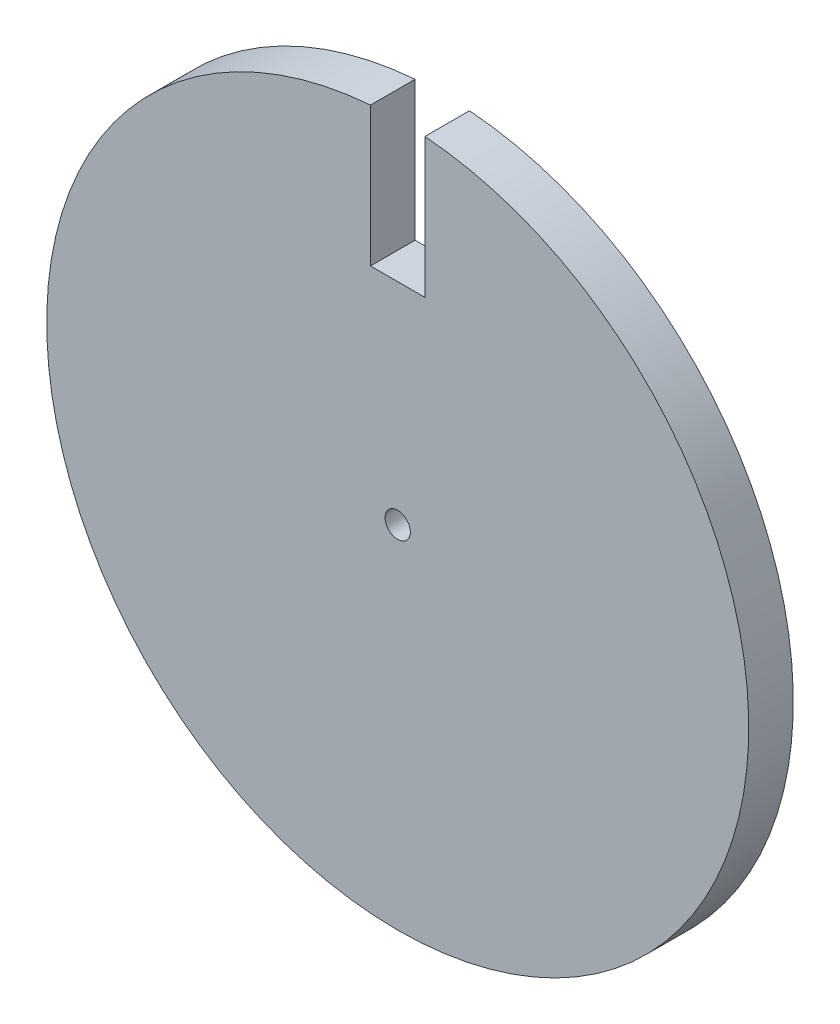
from build123d import *

# Parameters (mm, degrees)
SKETCH1_R           = 25
SKETCH1_R_2         = 0.9
BOSS_EXTRUDE1_DEPTH = 1.5875
CUT_EXTRUDE1_REACH  = 37.498
SKETCH2_W           = 3.873993702
SKETCH2_H           = 19.044786736


with BuildPart() as part:
    # Sketch1 → Boss-Extrude1 (new, symmetric)
    with BuildSketch(Plane.XY):
        Circle(SKETCH1_R)
        Circle(SKETCH1_R_2, mode=Mode.SUBTRACT)
    extrude(amount=BOSS_EXTRUDE1_DEPTH, both=True)

    # Sketch2 → Cut-Extrude1 (cut, up to next)
    with BuildSketch(Plane(origin=(0, 0, -1.5875), x_dir=(-1, 0, 0), z_dir=(0, 0, -1)), mode=Mode.PRIVATE) as cut_extrude1_sk1:
        with Locations((0, 24.522393368)):
            Rectangle(SKETCH2_W, SKETCH2_H)
    cut_extrude1_tool1 = extrude(cut_extrude1_sk1.sketch, amount=-CUT_EXTRUDE1_REACH, mode=Mode.PRIVATE) & part.part
    add(cut_extrude1_tool1.solids().sort_by_distance((0, 24.522393, -1.5875))[0], mode=Mode.SUBTRACT)


solid = part.part
